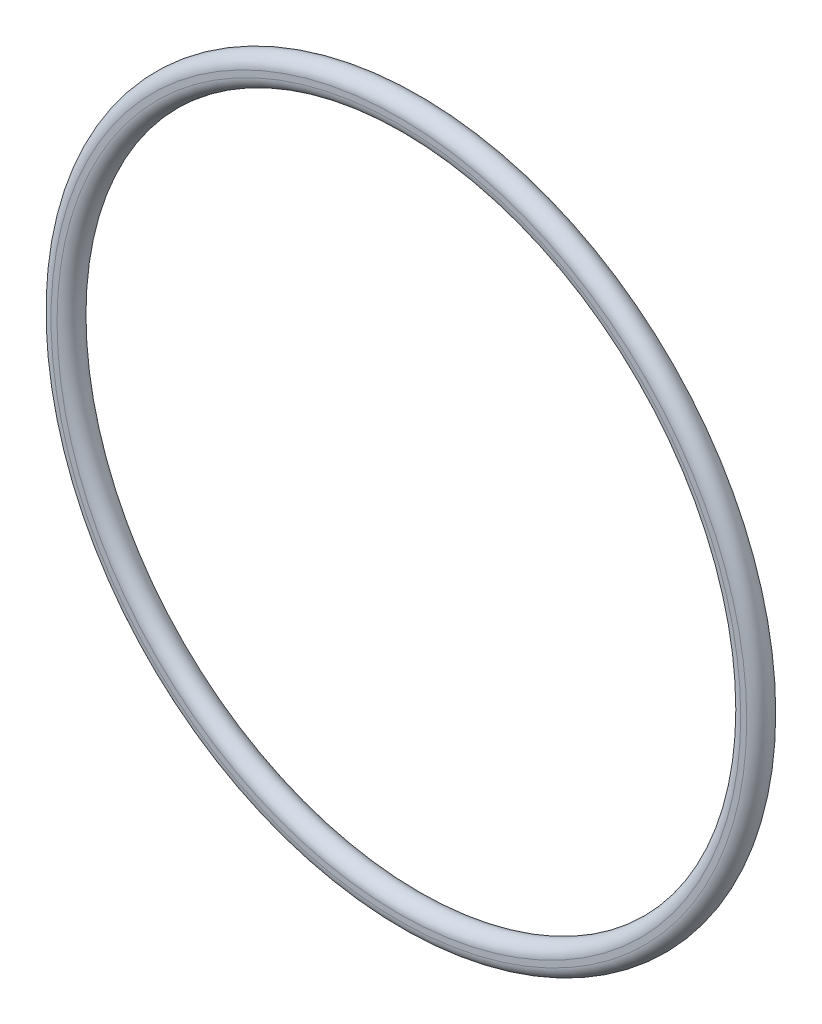
from build123d import *

# Parameters (mm, degrees)
SKETCH1_R = 0.79375


with BuildPart() as part:
    # Sketch1 → Revolve1 (revolve)
    with BuildSketch(Plane(origin=(0, 0, 0), x_dir=(1, 0, 0), z_dir=(0, 1, 0))):
        with BuildLine():
            Line((22.621875, -0.79375), (23.01875, -0.79375))
            ThreePointArc((23.01875, -0.79375), (22.225, 0), (23.01875, 0.79375))
            Line((23.01875, 0.79375), (22.621875, 0.79375))
            ThreePointArc((22.621875, 0.79375), (21.828125, 0), (22.621875, -0.79375))
        make_face()
        with Locations((23.01875, 0)):
            Circle(SKETCH1_R)
    revolve(axis=Axis((0, 0, 0), (0, 0, -1)))


solid = part.part
